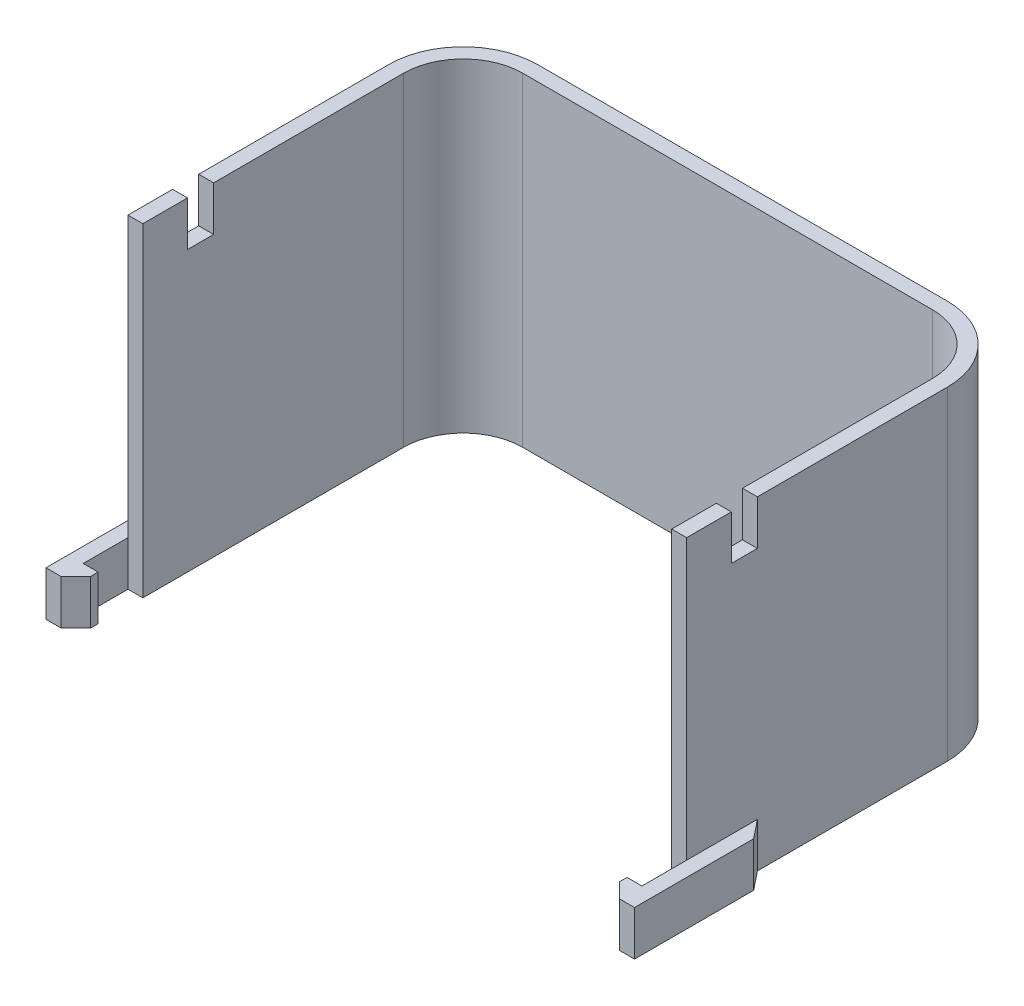
from build123d import *

# Parameters (mm, degrees)
BOSS_EXTRUDE1_DEPTH = 43.5
FILLET1_R           = 8
FILLET2_R           = 10
SKETCH3_W           = 3.5
SKETCH3_H           = 6
CUT_EXTRUDE1_DEPTH  = 57.75
BOSS_EXTRUDE2_DEPTH = 6


with BuildPart() as part:
    # Sketch2 → Boss-Extrude1 (new body)
    with BuildSketch(Plane(origin=(0, 0, 0), x_dir=(1, 0, 0), z_dir=(0, 1, 0))):
        Polygon((35.39315693, 0), (37.39315693, 0), (37.39315693, 45), (-37.60684307, 45), (-37.60684307, 0), (-35.60684307, 0), (-35.60684307, 43), (35.39315693, 43), align=None)
    extrude(amount=BOSS_EXTRUDE1_DEPTH)

    # Fillet1
    fillet1_edges = [part.edges().sort_by_distance(p)[0] for p in [
        (35.39315693, 21.75, -43),
        (-35.60684307, 21.75, -43),
    ]]
    fillet(fillet1_edges, radius=FILLET1_R)

    # Fillet2
    fillet2_edges = [part.edges().sort_by_distance(p)[0] for p in [
        (-37.60684307, 21.75, -45),
        (37.39315693, 21.75, -45),
    ]]
    fillet(fillet2_edges, radius=FILLET2_R)

    # Sketch3 → Cut-Extrude1 (cut, symmetric)
    with BuildSketch(Plane(origin=(0, 0, 0), x_dir=(0, 0, -1), z_dir=(1, 0, 0))):
        with Locations((7.75, 40.5)):
            Rectangle(SKETCH3_W, SKETCH3_H)
    extrude(amount=CUT_EXTRUDE1_DEPTH, both=True, mode=Mode.SUBTRACT)

    # Sketch4 → Boss-Extrude2 (add)
    with BuildSketch(Plane.XZ):
        Polygon((-37.60684307, -7), (-37.60684307, 6), (-35.60684307, 6), (-35.60684307, 7), (-37.60684307, 9), (-39.60684307, 9), (-39.60684307, -7), (-37.60684307, -9.5), align=None)
        Polygon((37.39315693, -7), (37.39315693, 6), (35.39315693, 6), (35.39315693, 7), (37.39315693, 9), (39.39315693, 9), (39.39315693, -7), (37.39315693, -9.5), align=None)
    extrude(amount=-BOSS_EXTRUDE2_DEPTH)


solid = part.part
